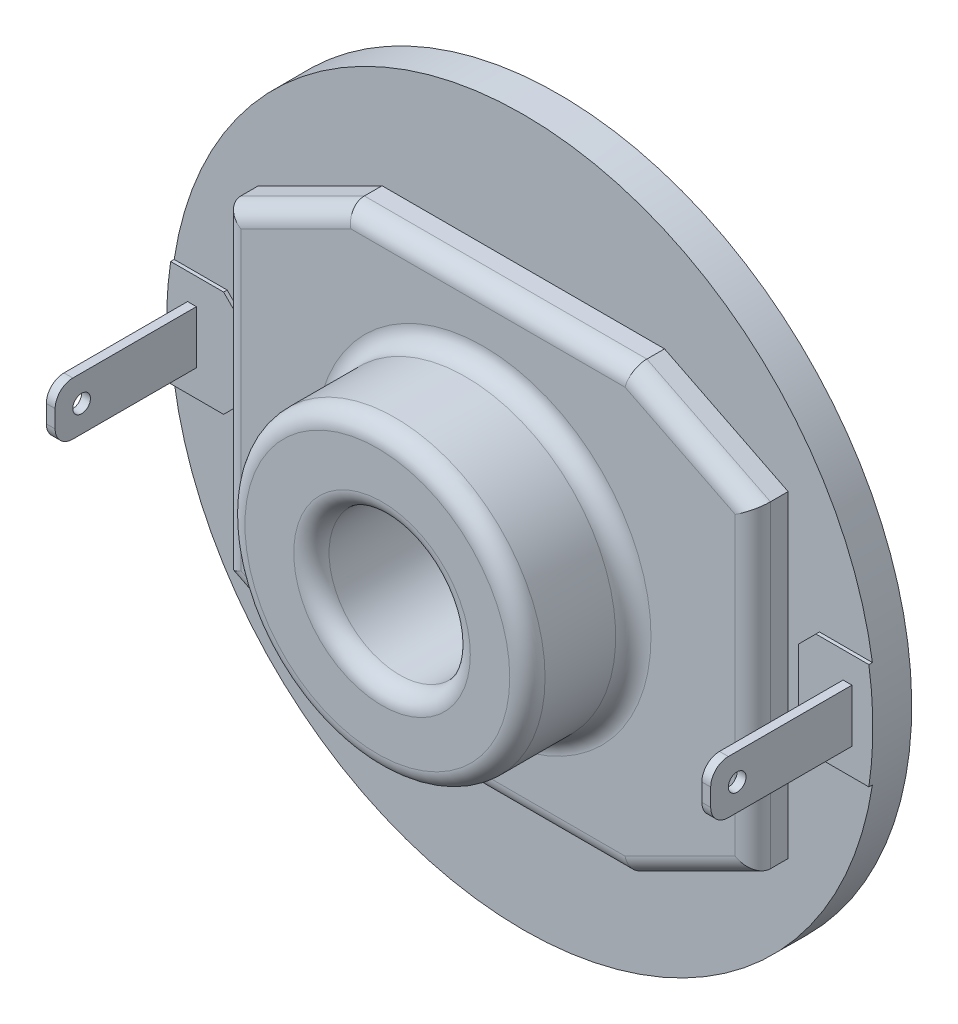
from build123d import *
from build123d.topology import SkipClean

# Parameters (mm, degrees)
BOSS_EXTRUDE1_DEPTH = 2
SKETCH2_R           = 20
BOSS_EXTRUDE2_DEPTH = 2
FILLET1_R           = 1
SKETCH3_R           = 8.5
BOSS_EXTRUDE3_DEPTH = 6
SKETCH4_R           = 4
CUT_EXTRUDE1_DEPTH  = 31
FILLET2_R           = 1
BOSS_EXTRUDE4_START = 0.2
BOSS_EXTRUDE4_DEPTH = 0.2
SKETCH6_W           = 0.5
SKETCH6_H           = 3
BOSS_EXTRUDE5_DEPTH = 8
FILLET3_R           = 1
SKETCH7_R           = 0.5
CUT_EXTRUDE2_DEPTH  = 4
CUT_EXTRUDE3_START  = -4
SKETCH8_R           = 0.5
CUT_EXTRUDE3_DEPTH  = 4


with BuildPart() as part:
    # Sketch1 → Boss-Extrude1 (new body)
    with BuildSketch(Plane.XY):
        Polygon((-15, 9), (-8, 12.5), (8, 12.5), (15, 9), (15, -9), (8, -12.5), (-8, -12.5), (-15, -9), align=None)
    extrude(amount=BOSS_EXTRUDE1_DEPTH)

    # Sketch2 → Boss-Extrude2 (add)
    with BuildSketch(Plane(origin=(0, 0, 0), x_dir=(-1, 0, 0), z_dir=(0, 0, -1))):
        Circle(SKETCH2_R)
    extrude(amount=BOSS_EXTRUDE2_DEPTH)

    # Fillet1
    fillet1_edges = [part.edges().sort_by_distance(p)[0] for p in [
        (-15, 0, 2),
        (-11.5, -10.75, 2),
        (0, -12.5, 2),
        (11.5, -10.75, 2),
        (15, 0, 2),
        (11.5, 10.75, 2),
        (0, 12.5, 2),
        (-11.5, 10.75, 2),
    ]]
    fillet(fillet1_edges, radius=FILLET1_R)

    # Sketch3 → Boss-Extrude3 (add)
    with BuildSketch(Plane.XY.offset(2)):
        with Locations(Location((-0.2660856, 0, 0), (0, 0, 180))):
            Circle(SKETCH3_R)
    extrude(amount=BOSS_EXTRUDE3_DEPTH)

    # Sketch4 → Cut-Extrude1 (cut, through all)
    with BuildSketch(Plane.XY.offset(8)):
        Circle(SKETCH4_R)
    extrude(amount=-CUT_EXTRUDE1_DEPTH, mode=Mode.SUBTRACT)

    # Fillet2
    fillet2_edges = [part.edges().sort_by_distance(p)[0] for p in [
        (8.2339144, 0, 2),
        (8.2339144, 0, 8),
        (-4, 0, 8),
    ]]
    fillet(fillet2_edges, radius=FILLET2_R)

    # Sketch5 → Boss-Extrude4 (add)
    with SkipClean():  # the faces are left unmerged after this step: merging them gives an invalid solid
        with BuildSketch(Plane.XY.offset(BOSS_EXTRUDE4_START)):
            with BuildLine():
                Line((-19.773719933, 3), (-16.773719933, 3))
                Line((-16.773719933, 3), (-15.773719933, 2))
                Line((-15.773719933, 2), (-15.773719933, -2))
                Line((-15.773719933, -2), (-16.773719933, -3))
                Line((-16.773719933, -3), (-19.773719933, -3))
                ThreePointArc((-19.773719933, -3), (-20, 0), (-19.773719933, 3))
            make_face()
            with BuildLine():
                Line((19.773719933, 3), (16.773719933, 3))
                Line((16.773719933, 3), (15.773719933, 2))
                Line((15.773719933, 2), (15.773719933, -2))
                Line((15.773719933, -2), (16.773719933, -3))
                Line((16.773719933, -3), (19.773719933, -3))
                ThreePointArc((19.773719933, -3), (20, 0), (19.773719933, 3))
            make_face()
        extrude(amount=-BOSS_EXTRUDE4_DEPTH)

    # Sketch6 → Boss-Extrude5 (add)
    with SkipClean():  # the faces are left unmerged after this step: merging them gives an invalid solid
        with BuildSketch(Plane.XY.offset(0.2)):
            with Locations((-18.564246067, 0.012841423)):
                Rectangle(SKETCH6_W, SKETCH6_H)
            with Locations((18.564246067, 0.012841423)):
                Rectangle(SKETCH6_W, SKETCH6_H)
        extrude(amount=BOSS_EXTRUDE5_DEPTH)

    # Fillet3
    fillet3_edges = [part.edges().sort_by_distance(p)[0] for p in [
        (-18.564246067, 1.512841423, 8.2),
        (-18.564246067, -1.487158577, 8.2),
        (18.564246067, 1.512841423, 8.2),
        (18.564246067, -1.487158577, 8.2),
    ]]
    fillet(fillet3_edges, radius=FILLET3_R)

    # Sketch7 → Cut-Extrude2 (cut)
    with BuildSketch(Plane.ZY.offset(18.814246067)):
        with Locations((6.7, 0.012841423)):
            Circle(SKETCH7_R)
    extrude(amount=-CUT_EXTRUDE2_DEPTH, mode=Mode.SUBTRACT)

    # Sketch8 → Cut-Extrude3 (cut)
    with BuildSketch(Plane(origin=(18.814246067, 0, 0), x_dir=(0, 0, -1), z_dir=(1, 0, 0)).offset(CUT_EXTRUDE3_START)):
        with Locations(Location((-6.7, 0.012841423, 0), (0, 0, 180))):
            Circle(SKETCH8_R)
    extrude(amount=CUT_EXTRUDE3_DEPTH, mode=Mode.SUBTRACT)


solid = part.part
